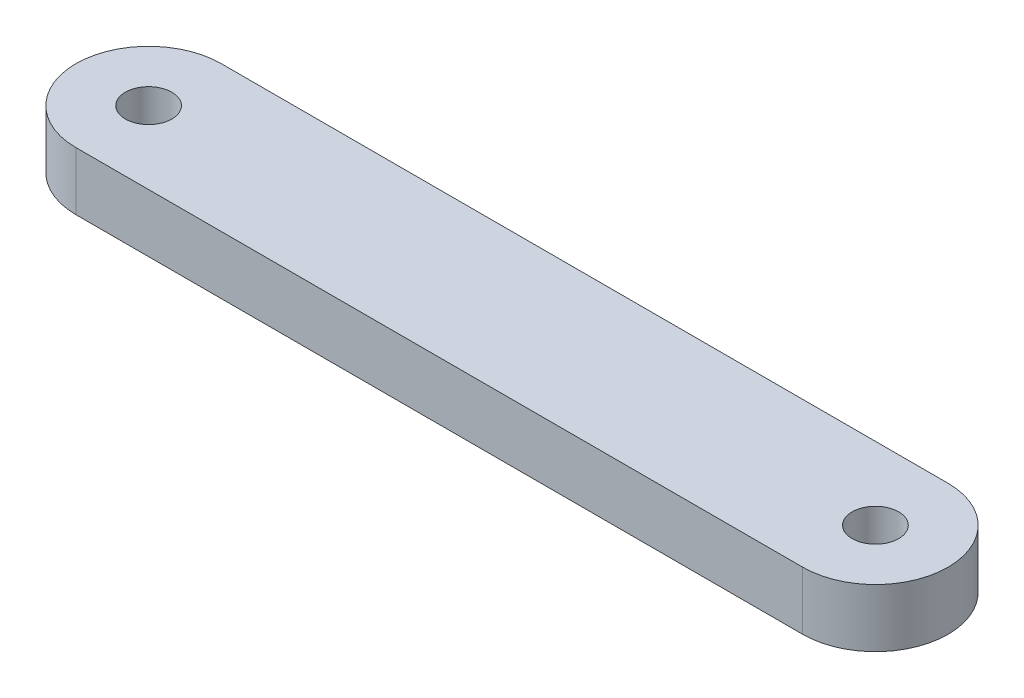
from build123d import *

# Parameters (mm, degrees)
SKETCH_1_R      = 1.6
EXTRUDE_1_DEPTH = 4


with BuildPart() as part:
    # ｽｹｯﾁ1 → ﾎﾞｽ - 押し出し1 (new body)
    with BuildSketch(Plane(origin=(0, 0, 0), x_dir=(1, 0, 0), z_dir=(0, 1, 0))):
        with BuildLine():
            Line((0, -5), (50, -5))
            ThreePointArc((50, -5), (55, 0), (50, 5))
            Line((50, 5), (0, 5))
            ThreePointArc((0, 5), (-5, 0), (0, -5))
        make_face()
        with Locations(Location((0, 0, 0), (0, 0, 270))):
            Circle(SKETCH_1_R, mode=Mode.SUBTRACT)
        with Locations(Location((50, 0, 0), (0, 0, 270))):
            Circle(SKETCH_1_R, mode=Mode.SUBTRACT)
    extrude(amount=EXTRUDE_1_DEPTH)


solid = part.part
